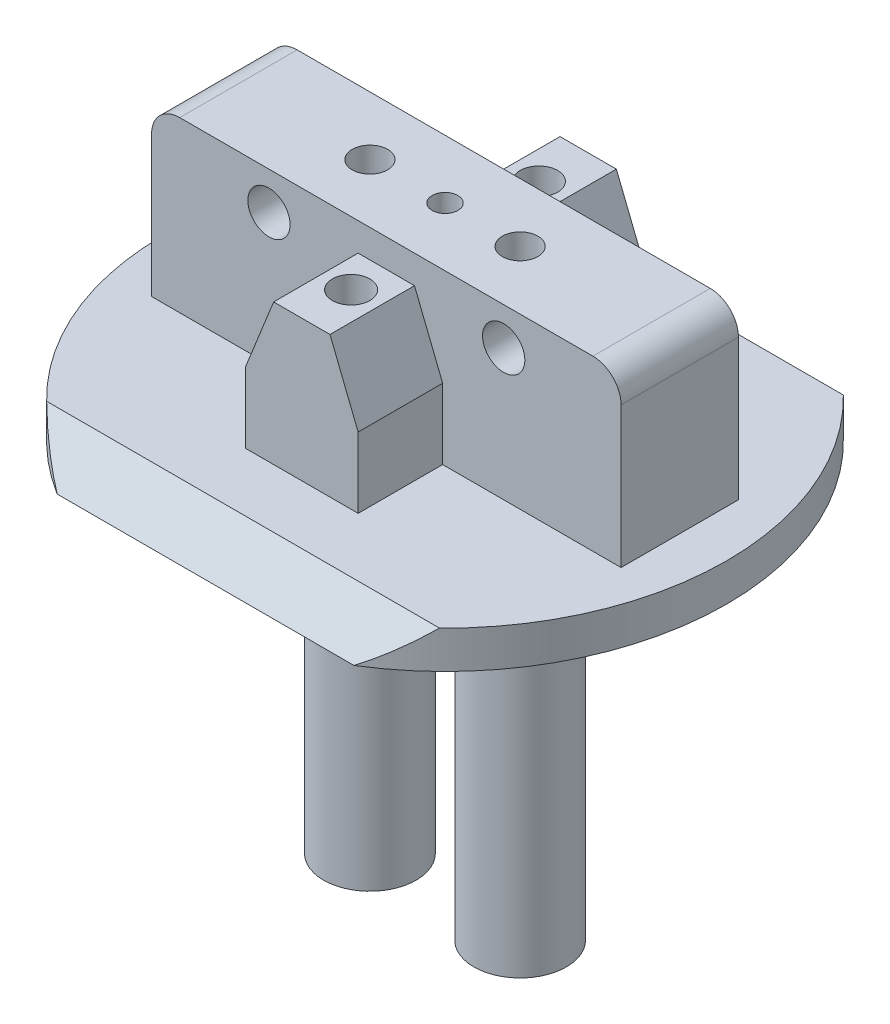
from build123d import *
from build123d.topology import SkipClean

# Parameters (mm, degrees)
SKETCH1_R                            = 30
BOSS_EXTRUDE1_DEPTH                  = 4
BOSS_EXTRUDE2_REACH                  = 44.615
BOSS_EXTRUDE2_END_RADIUS             = 30
BOSS_EXTRUDE2_DIRECTION_2_REACH      = 44.615
BOSS_EXTRUDE2_DIRECTION_2_END_RADIUS = 30
SKETCH3_OUTSIDE_W                    = 78.092
SKETCH3_OUTSIDE_H                    = 69.092
SKETCH3_OUTSIDE_R                    = 21.5
CUT_EXTRUDE2_DEPTH                   = 12.5
BOSS_EXTRUDE3_DEPTH                  = 18
BOSS_EXTRUDE4_DEPTH                  = 15
BOSS_EXTRUDE5_DEPTH                  = 15
CUT_EXTRUDE3_DEPTH                   = 44.292609069
CUT_EXTRUDE3_DEPTH_BACK              = 44.292609069
SKETCH8_R                            = 2
CUT_EXTRUDE8_DEPTH                   = 48.077064479
CUT_EXTRUDE8_DEPTH_BACK              = 48.077064479
CUT_EXTRUDE9_DEPTH                   = 59.659818207
CUT_EXTRUDE11_DEPTH                  = 20
CUT_EXTRUDE12_DEPTH                  = 20
CUT_EXTRUDE13_DEPTH                  = 20
CUT_EXTRUDE14_DEPTH                  = 44.292609069
CUT_EXTRUDE14_DEPTH_BACK             = 44.292609069
SKETCH25_W                           = 66.075437062
SKETCH25_H                           = 20.142243048
SKETCH27_R                           = 1.375
CUT_EXTRUDE16_DEPTH                  = 30
SKETCH28_R                           = 5
CUT_EXTRUDE17_DEPTH                  = 3
CUT_EXTRUDE18_DEPTH                  = 43.690748412
CUT_EXTRUDE18_DEPTH_BACK             = 43.690748412
SKETCH29_W                           = 43.412566799
SKETCH29_H                           = 13.326200919
SKETCH32_W                           = 50
SKETCH32_H                           = 12.5
BOSS_EXTRUDE6_DEPTH                  = 18
SKETCH35_W                           = 12
SKETCH35_H                           = 15
BOSS_EXTRUDE7_DEPTH                  = 9
CUT_EXTRUDE19_DEPTH                  = 49.908715992
CUT_EXTRUDE19_DEPTH_BACK             = 49.908715992
SKETCH37_R                           = 2.25
SKETCH36_R                           = 2
CUT_EXTRUDE20_DEPTH                  = 15
SKETCH39_W                           = 12
SKETCH39_H                           = 15
BOSS_EXTRUDE8_DEPTH                  = 9
SKETCH40_R                           = 2
CUT_EXTRUDE21_DEPTH                  = 15
FILLET1_R                            = 3
FILLET2_R                            = 3
CUT_EXTRUDE24_START                  = -20
SKETCH44_R                           = 1.375
CUT_EXTRUDE24_DEPTH                  = 20
SKETCH45_R                           = 4.925
BOSS_EXTRUDE9_DEPTH                  = 42
SKETCH46_R                           = 1.8923
CUT_EXTRUDE25_DEPTH                  = 76.2
SKETCH47_R                           = 1.8923
CUT_EXTRUDE26_DEPTH                  = 76.2
CUT_EXTRUDE32_DEPTH                  = 9
CUT_EXTRUDE33_DEPTH                  = 9
CUT_EXTRUDE34_DEPTH                  = 9
CUT_EXTRUDE35_DEPTH                  = 9


with BuildPart() as part:
    # Sketch1 → Boss-Extrude1 (new body)
    with BuildSketch(Plane(origin=(0, 0, 0), x_dir=(1, 0, 0), z_dir=(0, 1, 0))):
        with Locations(Location((0, 0, 0), (0, 0, 270))):
            Circle(SKETCH1_R)
    extrude(amount=BOSS_EXTRUDE1_DEPTH)

    # Boss-Extrude2: up to this cylinder (the profile starts inside it)
    with SkipClean():  # the faces are left unmerged after this step: merging them gives an invalid solid
        boss_extrude2_end = Plane(origin=(0, 9.396175, 0), z_dir=(0, -1, 0)) * Cylinder(BOSS_EXTRUDE2_END_RADIUS, 150.23, mode=Mode.PRIVATE)
        # Sketch2 → Boss-Extrude2 (add, up to the surface)
        with BuildSketch(Plane(origin=(0, 0, 0), x_dir=(0, 0, -1), z_dir=(1, 0, 0)), mode=Mode.PRIVATE) as boss_extrude2_sk1:
            Polygon((0, 4), (21.5, 4), (9, 16.5), (-9, 16.5), (-21.5, 4), align=None)
        boss_extrude2_tool1 = extrude(boss_extrude2_sk1.sketch, amount=BOSS_EXTRUDE2_REACH, mode=Mode.PRIVATE) & boss_extrude2_end
        add(boss_extrude2_tool1.solids().sort_by_distance((0, 9.396175, 0))[0])

    # Boss-Extrude2 direction 2: up to this cylinder (the profile starts inside it)
    with SkipClean():  # the faces are left unmerged after this step: merging them gives an invalid solid
        boss_extrude2_direction_2_end = Plane(origin=(0, 9.396175, 0), z_dir=(0, -1, 0)) * Cylinder(BOSS_EXTRUDE2_DIRECTION_2_END_RADIUS, 150.23, mode=Mode.PRIVATE)
        # Sketch2 → Boss-Extrude2 direction 2 (add, up to the surface)
        with BuildSketch(Plane(origin=(0, 0, 0), x_dir=(0, 0, -1), z_dir=(1, 0, 0)), mode=Mode.PRIVATE) as boss_extrude2_direction_2_sk1:
            Polygon((0, 4), (21.5, 4), (9, 16.5), (-9, 16.5), (-21.5, 4), align=None)
        boss_extrude2_direction_2_tool1 = extrude(boss_extrude2_direction_2_sk1.sketch, amount=-BOSS_EXTRUDE2_DIRECTION_2_REACH, mode=Mode.PRIVATE) & boss_extrude2_direction_2_end
        add(boss_extrude2_direction_2_tool1.solids().sort_by_distance((0, 9.396175, 0))[0])

    # SurfaceCut1
    split(bisect_by=Plane(origin=(0, 12.75, -12.75), x_dir=(1, 0, 0), z_dir=(0, 0.7071067811865558, -0.7071067811865392)), keep=Keep.BOTTOM)

    # SurfaceCut2
    split(bisect_by=Plane(origin=(0, 12.75, 12.75), x_dir=(1, 0, 0), z_dir=(0, 0.7071067811865509, 0.7071067811865442)), keep=Keep.BOTTOM)

    # Sketch3 outside → Cut-Extrude2 (cut)
    with BuildSketch(Plane(origin=(0, 4, 0), x_dir=(1, 0, 0), z_dir=(0, 1, 0))):
        Rectangle(SKETCH3_OUTSIDE_W, SKETCH3_OUTSIDE_H)
        Circle(SKETCH3_OUTSIDE_R, mode=Mode.SUBTRACT)
    extrude(amount=CUT_EXTRUDE2_DEPTH, mode=Mode.SUBTRACT)

    # Sketch5 → Boss-Extrude3 (add)
    with BuildSketch(Plane(origin=(0, 0, 0), x_dir=(-1, 0, 0), z_dir=(0, -1, 0))):
        Polygon((0, -6), (-17.5, -6), (-17.5, 6), (17.5, 6), (17.5, -6), align=None)
    extrude(amount=BOSS_EXTRUDE3_DEPTH)

    # Sketch6 → Boss-Extrude4 (add)
    with BuildSketch(Plane.XZ):
        Polygon((0, 15), (7, 15), (7, 6), (-7, 6), (-7, 15), align=None)
    extrude(amount=BOSS_EXTRUDE4_DEPTH)

    # Sketch7 → Boss-Extrude5 (add)
    with BuildSketch(Plane.XZ):
        Polygon((0, -15), (7, -15), (7, -6), (-7, -6), (-7, -15), align=None)
    extrude(amount=BOSS_EXTRUDE5_DEPTH)

    # Sketch8 → Cut-Extrude3 (cut, two sides: drawn at the far end of the back side and taken through both)
    with BuildSketch(Plane.XY.offset(-CUT_EXTRUDE3_DEPTH_BACK)):
        with Locations((-12.5, -12.5)):
            Circle(SKETCH8_R)
        with Locations((12.5, -12.5)):
            Circle(SKETCH8_R)
    extrude(amount=CUT_EXTRUDE3_DEPTH + CUT_EXTRUDE3_DEPTH_BACK, mode=Mode.SUBTRACT)

    # Sketch16 → Cut-Extrude8 (cut, two sides: drawn at the far end of the back side and taken through both)
    with BuildSketch(Plane.XY.offset(6).offset(-CUT_EXTRUDE8_DEPTH_BACK)):
        Polygon((17.5, -18), (17.5, -14.5), (14, -18), align=None)
        Polygon((-17.5, -18), (-14, -18), (-17.5, -14.5), align=None)
    extrude(amount=CUT_EXTRUDE8_DEPTH + CUT_EXTRUDE8_DEPTH_BACK, mode=Mode.SUBTRACT)

    # Sketch17 → Cut-Extrude9 (cut, through all)
    with BuildSketch(Plane(origin=(10.365975269, -9.674910251, -8.062425209), x_dir=(-0.3613483622370374, 0.337258471421235, -0.8693009171531012), z_dir=(0.6355070151731325, -0.5931398808282571, -0.49428323402354774))):
        Polygon((-2.372510104, -6.189601271), (7.980636686, -0.706686759), (7.980636686, -10.965829024), align=None)
    extrude(amount=CUT_EXTRUDE9_DEPTH, mode=Mode.SUBTRACT)

    # Sketch19 → Cut-Extrude11 (cut)
    with BuildSketch(Plane(origin=(-10.365975269, -9.674910251, -8.062425209), x_dir=(0.3613483622370374, 0.33725847142123494, -0.8693009171531012), z_dir=(0.6355070151731324, 0.5931398808282571, 0.4942832340235476))):
        Polygon((-2.372510104, -6.189601271), (7.980636686, -10.965829024), (7.980636686, -0.706686759), align=None)
    extrude(amount=-CUT_EXTRUDE11_DEPTH, mode=Mode.SUBTRACT)

    # Sketch20 → Cut-Extrude12 (cut)
    with BuildSketch(Plane(origin=(-10.365975269, -9.674910251, 8.062425209), x_dir=(-0.3613483622370374, -0.3372584714212349, -0.8693009171531013), z_dir=(0.6355070151731326, 0.593139880828257, -0.49428323402354757))):
        Polygon((2.372510104, -6.189601271), (-7.980636686, -0.706686759), (-7.980636686, -10.965829024), align=None)
    extrude(amount=-CUT_EXTRUDE12_DEPTH, mode=Mode.SUBTRACT)

    # Sketch21 → Cut-Extrude13 (cut)
    with BuildSketch(Plane(origin=(10.365975269, -9.674910251, 8.062425209), x_dir=(-0.3613483622370374, 0.3372584714212349, 0.8693009171531013), z_dir=(-0.6355070151731326, 0.593139880828257, -0.49428323402354757))):
        Polygon((-2.372510104, -6.189601271), (7.980636686, -0.706686759), (7.980636686, -10.965829024), align=None)
    extrude(amount=-CUT_EXTRUDE13_DEPTH, mode=Mode.SUBTRACT)

    # Sketch25 → Cut-Extrude14 (cut, two sides: drawn at the far end of the back side and taken through both)
    with BuildSketch(Plane.XY.offset(-CUT_EXTRUDE14_DEPTH_BACK)):
        with Locations((0, -10.071121524)):
            Rectangle(SKETCH25_W, SKETCH25_H)
    extrude(amount=CUT_EXTRUDE14_DEPTH + CUT_EXTRUDE14_DEPTH_BACK, mode=Mode.SUBTRACT)

    # Sketch27 → Cut-Extrude16 (cut)
    with BuildSketch(Plane(origin=(0, 16.5, 0), x_dir=(1, 0, 0), z_dir=(0, 1, 0))):
        with Locations(Location((0, 0, 0), (0, 0, 270))):
            Circle(SKETCH27_R)
    extrude(amount=-CUT_EXTRUDE16_DEPTH, mode=Mode.SUBTRACT)

    # Sketch28 → Cut-Extrude17 (cut)
    with BuildSketch(Plane.XZ):
        with Locations(Location((0, -15, 0), (0, 0, 270))):
            Circle(SKETCH28_R)
        with Locations(Location((22, 0, 0), (0, 0, 270))):
            Circle(SKETCH28_R)
        with Locations(Location((0, 15, 0), (0, 0, 270))):
            Circle(SKETCH28_R)
        with Locations(Location((-22, 0, 0), (0, 0, 270))):
            Circle(SKETCH28_R)
        with Locations(Location((-14, 12, 0), (0, 0, 270))):
            Circle(SKETCH28_R)
        with Locations(Location((14, 12, 0), (0, 0, 270))):
            Circle(SKETCH28_R)
        with Locations(Location((14, -12, 0), (0, 0, 270))):
            Circle(SKETCH28_R)
        with Locations(Location((-14, -12, 0), (0, 0, 270))):
            Circle(SKETCH28_R)
    extrude(amount=-CUT_EXTRUDE17_DEPTH, mode=Mode.SUBTRACT)

    # Sketch29 → Cut-Extrude18 (cut, two sides: drawn at the far end of the back side and taken through both)
    with BuildSketch(Plane(origin=(0, 0, 0), x_dir=(0, 0, -1), z_dir=(1, 0, 0)).offset(-CUT_EXTRUDE18_DEPTH_BACK)):
        with Locations((0.2062834, 10.66310046)):
            Rectangle(SKETCH29_W, SKETCH29_H)
    extrude(amount=CUT_EXTRUDE18_DEPTH + CUT_EXTRUDE18_DEPTH_BACK, mode=Mode.SUBTRACT)

    # Sketch32 → Boss-Extrude6 (add)
    with BuildSketch(Plane(origin=(0, 4, 0), x_dir=(1, 0, 0), z_dir=(0, 1, 0))):
        Rectangle(SKETCH32_W, SKETCH32_H)
    extrude(amount=BOSS_EXTRUDE6_DEPTH)

    # Sketch35 → Boss-Extrude7 (add)
    with BuildSketch(Plane(origin=(0, 0, -6.25), x_dir=(-1, 0, 0), z_dir=(0, 0, -1))):
        with Locations((0, 11.5)):
            Rectangle(SKETCH35_W, SKETCH35_H)
    extrude(amount=BOSS_EXTRUDE7_DEPTH)

    # Sketch37 → Cut-Extrude19 (cut, two sides: drawn at the far end of the back side and taken through both)
    with BuildSketch(Plane(origin=(0, 0, -6.25), x_dir=(-1, 0, 0), z_dir=(0, 0, -1)).offset(-CUT_EXTRUDE19_DEPTH_BACK)):
        with Locations((-12.5, 18)):
            Circle(SKETCH37_R)
        with Locations((12.5, 18)):
            Circle(SKETCH37_R)
    extrude(amount=CUT_EXTRUDE19_DEPTH + CUT_EXTRUDE19_DEPTH_BACK, mode=Mode.SUBTRACT)

    # Sketch36 → Cut-Extrude20 (cut)
    with BuildSketch(Plane(origin=(0, 19, 0), x_dir=(1, 0, 0), z_dir=(0, 1, 0))):
        with Locations(Location((0, 10, 0), (0, 0, 270))):
            Circle(SKETCH36_R)
    extrude(amount=-CUT_EXTRUDE20_DEPTH, mode=Mode.SUBTRACT)

    # Sketch39 → Boss-Extrude8 (add)
    with BuildSketch(Plane.XY.offset(6.25)):
        with Locations((0, 11.5)):
            Rectangle(SKETCH39_W, SKETCH39_H)
    extrude(amount=BOSS_EXTRUDE8_DEPTH)

    # Sketch40 → Cut-Extrude21 (cut)
    with BuildSketch(Plane(origin=(0, 19, 0), x_dir=(1, 0, 0), z_dir=(0, 1, 0))):
        with Locations(Location((0, -10, 0), (0, 0, 270))):
            Circle(SKETCH40_R)
    extrude(amount=-CUT_EXTRUDE21_DEPTH, mode=Mode.SUBTRACT)

    # Fillet1
    fillet1_edges = [part.edges().sort_by_distance(p)[0] for p in [
        (25, 22, 0),
    ]]
    fillet(fillet1_edges, radius=FILLET1_R)

    # Fillet2
    fillet2_edges = [part.edges().sort_by_distance(p)[0] for p in [
        (-25, 22, 0),
    ]]
    fillet(fillet2_edges, radius=FILLET2_R)

    # Sketch44 → Cut-Extrude24 (cut)
    with BuildSketch(Plane.XZ.offset(-4).offset(CUT_EXTRUDE24_START)):
        with Locations(Location((0, 0, 0), (0, 0, 90))):
            Circle(SKETCH44_R)
    extrude(amount=CUT_EXTRUDE24_DEPTH, mode=Mode.SUBTRACT)

    # Sketch45 → Boss-Extrude9 (add)
    with BuildSketch(Plane.XZ):
        with Locations(Location((-8, 0, 0), (0, 0, 90))):
            Circle(SKETCH45_R)
        with Locations(Location((8, 0, 0), (0, 0, 90))):
            Circle(SKETCH45_R)
    extrude(amount=BOSS_EXTRUDE9_DEPTH)

    # Sketch46 → Cut-Extrude25 (cut)
    with BuildSketch(Plane.XZ.offset(42)):
        with Locations(Location((-8, 0, 0), (0, 0, 270))):
            Circle(SKETCH46_R)
    extrude(amount=-CUT_EXTRUDE25_DEPTH, mode=Mode.SUBTRACT)

    # Sketch47 → Cut-Extrude26 (cut)
    with BuildSketch(Plane.XZ.offset(42)):
        with Locations(Location((8, 0, 0), (0, 0, 270))):
            Circle(SKETCH47_R)
    extrude(amount=-CUT_EXTRUDE26_DEPTH, mode=Mode.SUBTRACT)

    # Sketch58 → Cut-Extrude32 (cut)
    with BuildSketch(Plane(origin=(0, 0, -15.25), x_dir=(-1, 0, 0), z_dir=(0, 0, -1))):
        Polygon((6, 19), (6, 11.5), (3, 19), align=None)
    extrude(amount=-CUT_EXTRUDE32_DEPTH, mode=Mode.SUBTRACT)

    # Sketch59 → Cut-Extrude33 (cut)
    with BuildSketch(Plane(origin=(0, 0, -15.25), x_dir=(-1, 0, 0), z_dir=(0, 0, -1))):
        Polygon((-6, 19), (-6, 11.5), (-3, 19), align=None)
    extrude(amount=-CUT_EXTRUDE33_DEPTH, mode=Mode.SUBTRACT)

    # Sketch60 → Cut-Extrude34 (cut)
    with BuildSketch(Plane.XY.offset(15.25)):
        Polygon((6, 11.5), (6, 19), (3, 19), align=None)
    extrude(amount=-CUT_EXTRUDE34_DEPTH, mode=Mode.SUBTRACT)

    # Sketch61 → Cut-Extrude35 (cut)
    with BuildSketch(Plane.XY.offset(15.25)):
        Polygon((-6, 19), (-6, 11.5), (-3, 19), align=None)
    extrude(amount=-CUT_EXTRUDE35_DEPTH, mode=Mode.SUBTRACT)


solid = part.part
